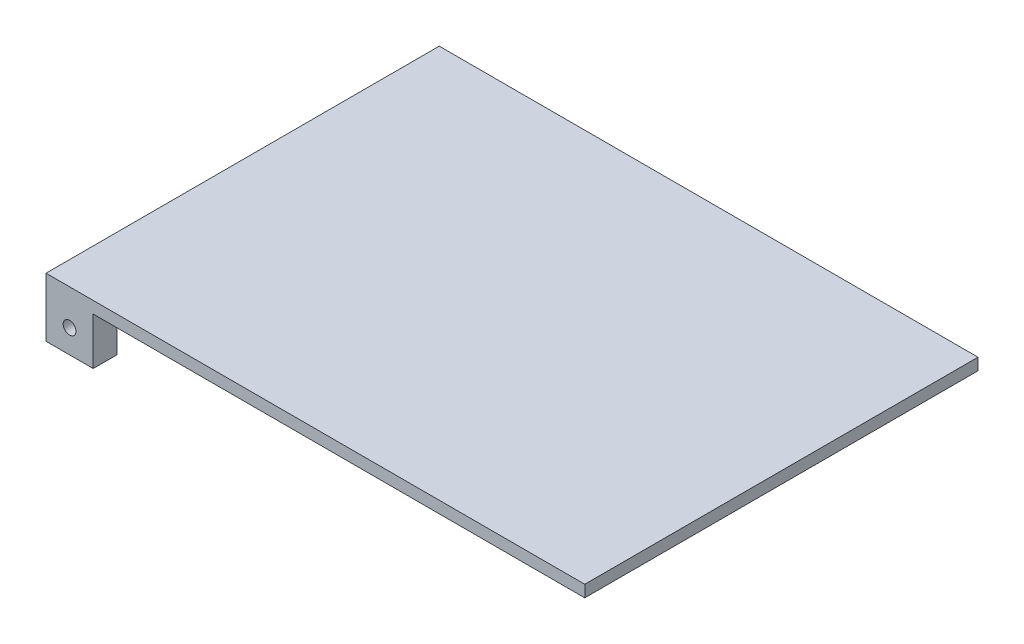
from build123d import *

# Parameters (mm, degrees)
SKETCH1_W           = 150
SKETCH1_H           = 100
BOSS_EXTRUDE1_DEPTH = 3
SKETCH2_W           = 12
SKETCH2_H           = 6
BOSS_EXTRUDE2_DEPTH = 12
SKETCH4_R           = 1.625
CUT_EXTRUDE1_DEPTH  = 181.676506497
SKETCH5_W           = 13
SKETCH5_H           = 100
CUT_EXTRUDE2_DEPTH  = 181.900525151


with BuildPart() as part:
    # Sketch1 → Boss-Extrude1 (new body)
    with BuildSketch(Plane(origin=(0, 0, 0), x_dir=(1, 0, 0), z_dir=(0, 1, 0))):
        with Locations((75, 50)):
            Rectangle(SKETCH1_W, SKETCH1_H)
    extrude(amount=BOSS_EXTRUDE1_DEPTH)

    # Sketch2 → Boss-Extrude2 (add)
    with BuildSketch(Plane.XZ):
        with Locations((6, -3)):
            Rectangle(SKETCH2_W, SKETCH2_H)
        with Locations((144, -3)):
            Rectangle(SKETCH2_W, SKETCH2_H)
        with Locations((144, -97)):
            Rectangle(SKETCH2_W, SKETCH2_H)
        with Locations((6, -97)):
            Rectangle(SKETCH2_W, SKETCH2_H)
    extrude(amount=BOSS_EXTRUDE2_DEPTH)

    # Sketch4 → Cut-Extrude1 (cut, through all)
    with BuildSketch(Plane.XY):
        with Locations((6, -6)):
            Circle(SKETCH4_R)
        with Locations(Location((144, -6, 0), (0, 0, 180))):
            Circle(SKETCH4_R)
    extrude(amount=-CUT_EXTRUDE1_DEPTH, mode=Mode.SUBTRACT)

    # Sketch5 → Cut-Extrude2 (cut, through all)
    with BuildSketch(Plane(origin=(0, 3, 0), x_dir=(1, 0, 0), z_dir=(0, 1, 0))):
        with Locations((143.5, 50)):
            Rectangle(SKETCH5_W, SKETCH5_H)
    extrude(amount=-CUT_EXTRUDE2_DEPTH, mode=Mode.SUBTRACT)


solid = part.part
